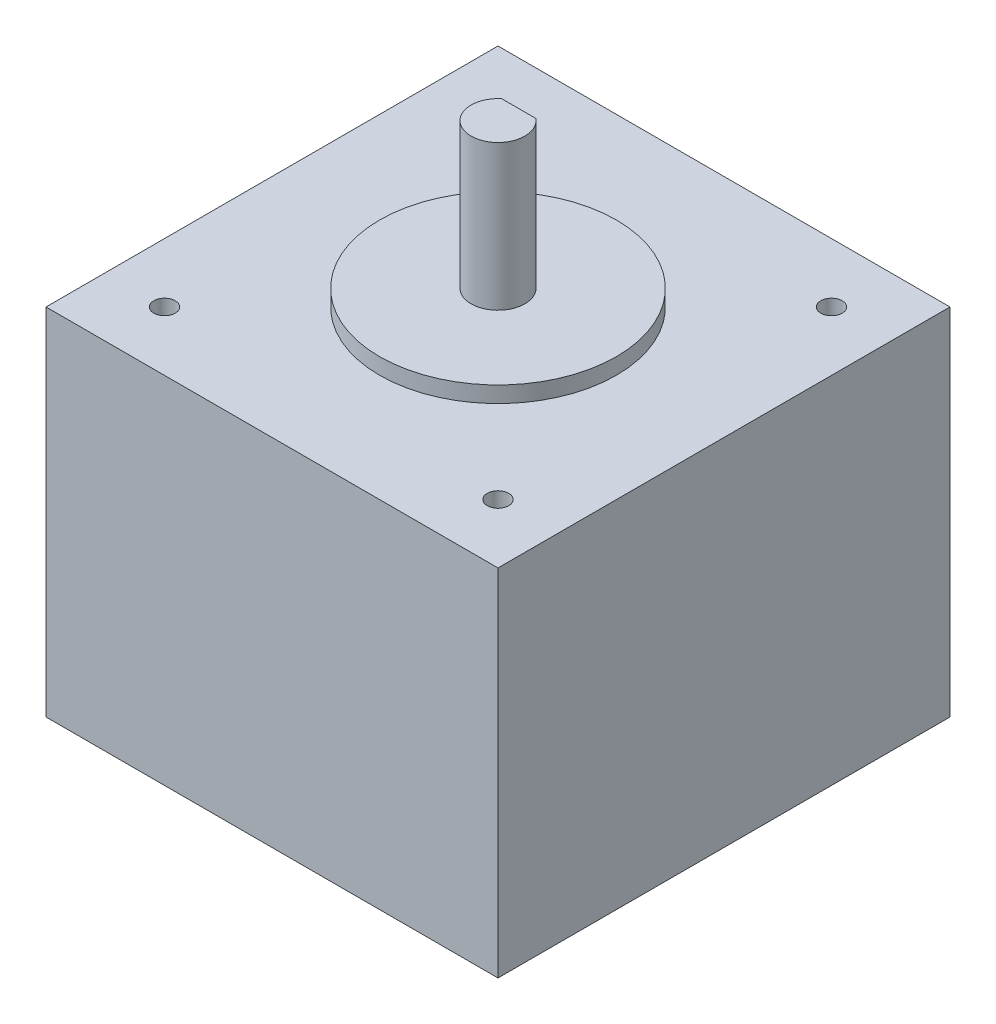
from build123d import *

# Parameters (mm, degrees)
SKETCH1_W           = 42
SKETCH1_H           = 42
BOSS_EXTRUDE1_DEPTH = 33
SKETCH2_R           = 1
CUT_EXTRUDE1_DEPTH  = 3.5
SKETCH3_R           = 11
BOSS_EXTRUDE2_DEPTH = 1.5
SKETCH4_R           = 2.5
BOSS_EXTRUDE3_DEPTH = 13.5
CUT_EXTRUDE2_START  = -13.5
CUT_EXTRUDE2_DEPTH  = 13.5


with BuildPart() as part:
    # Sketch1 → Boss-Extrude1 (new body)
    with BuildSketch(Plane(origin=(0, 0, 0), x_dir=(1, 0, 0), z_dir=(0, 1, 0))):
        with Locations((21, 21)):
            Rectangle(SKETCH1_W, SKETCH1_H)
    extrude(amount=BOSS_EXTRUDE1_DEPTH)

    # Sketch2 → Cut-Extrude1 (cut)
    with BuildSketch(Plane(origin=(0, 33, 0), x_dir=(1, 0, 0), z_dir=(0, 1, 0))):
        with Locations(Location((5.505, 36.495, 0), (0, 0, 270))):
            Circle(SKETCH2_R)
        with Locations(Location((36.495, 36.495, 0), (0, 0, 270))):
            Circle(SKETCH2_R)
        with Locations(Location((36.495, 5.505, 0), (0, 0, 270))):
            Circle(SKETCH2_R)
        with Locations(Location((5.505, 5.505, 0), (0, 0, 270))):
            Circle(SKETCH2_R)
    extrude(amount=-CUT_EXTRUDE1_DEPTH, mode=Mode.SUBTRACT)

    # Sketch3 → Boss-Extrude2 (add)
    with BuildSketch(Plane(origin=(0, 33, 0), x_dir=(1, 0, 0), z_dir=(0, 1, 0))):
        with Locations(Location((21, 21, 0), (0, 0, 90))):
            Circle(SKETCH3_R)
    extrude(amount=BOSS_EXTRUDE2_DEPTH)

    # Sketch4 → Boss-Extrude3 (add)
    with BuildSketch(Plane(origin=(0, 34.5, 0), x_dir=(1, 0, 0), z_dir=(0, 1, 0))):
        with Locations(Location((21, 21, 0), (0, 0, 270))):
            Circle(SKETCH4_R)
    extrude(amount=BOSS_EXTRUDE3_DEPTH)

    # Sketch5 → Cut-Extrude2 (cut)
    with BuildSketch(Plane(origin=(0, 48, 0), x_dir=(1, 0, 0), z_dir=(0, 1, 0)).offset(CUT_EXTRUDE2_START)):
        with BuildLine():
            Line((19.410943676, 22.93), (22.589056324, 22.93))
            ThreePointArc((22.589056324, 22.93), (21, 23.5), (19.410943676, 22.93))
        make_face()
    extrude(amount=CUT_EXTRUDE2_DEPTH, mode=Mode.SUBTRACT)


solid = part.part
